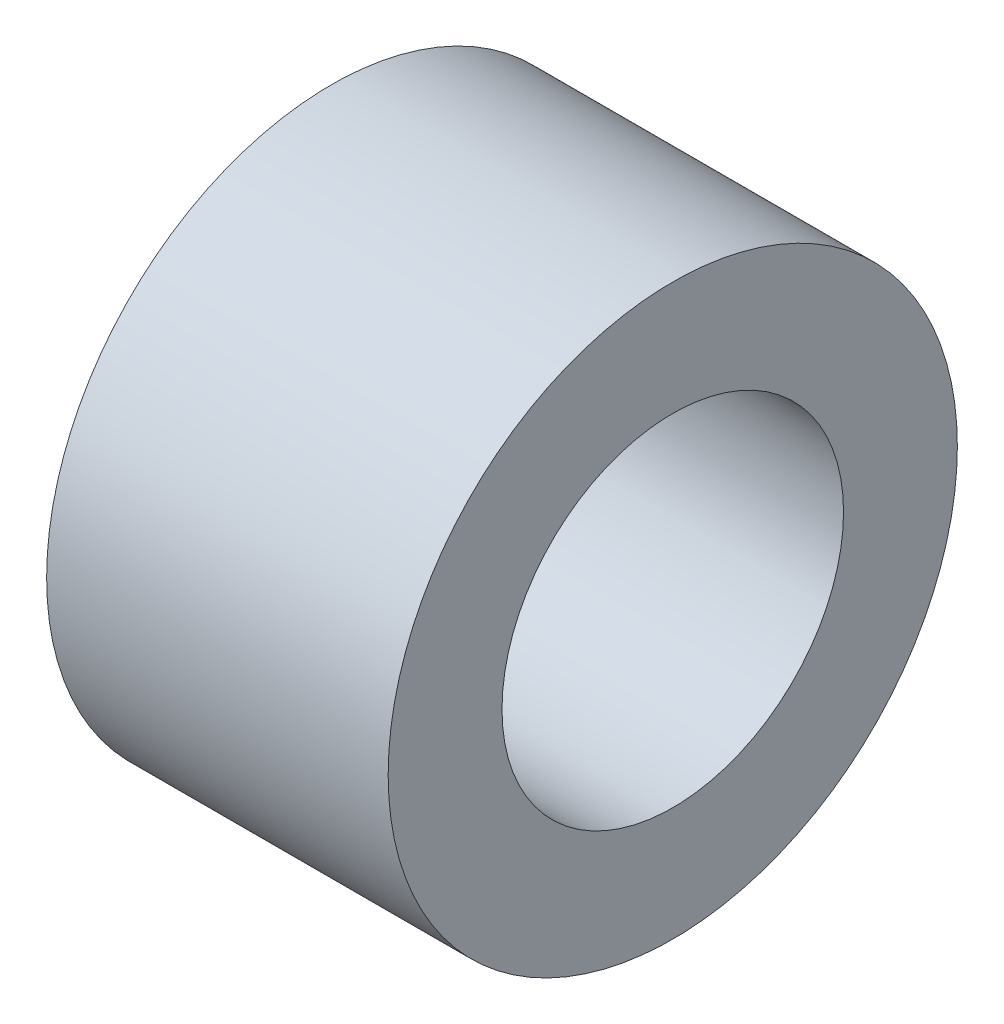
from build123d import *

# Parameters (mm, degrees)
SKETCH1_W = 15
SKETCH1_H = 5


with BuildPart() as part:
    # Sketch1 → Revolve1 (revolve)
    with BuildSketch(Plane.XY, mode=Mode.PRIVATE) as revolve1_sk:
        with Locations((7.5, 10)):
            Rectangle(SKETCH1_W, SKETCH1_H)
    revolve(revolve1_sk.sketch.rotate(Axis((0, 0, 0), (1, 0, 0)), 90), axis=Axis((0, 0, 0), (1, 0, 0)))


solid = part.part
